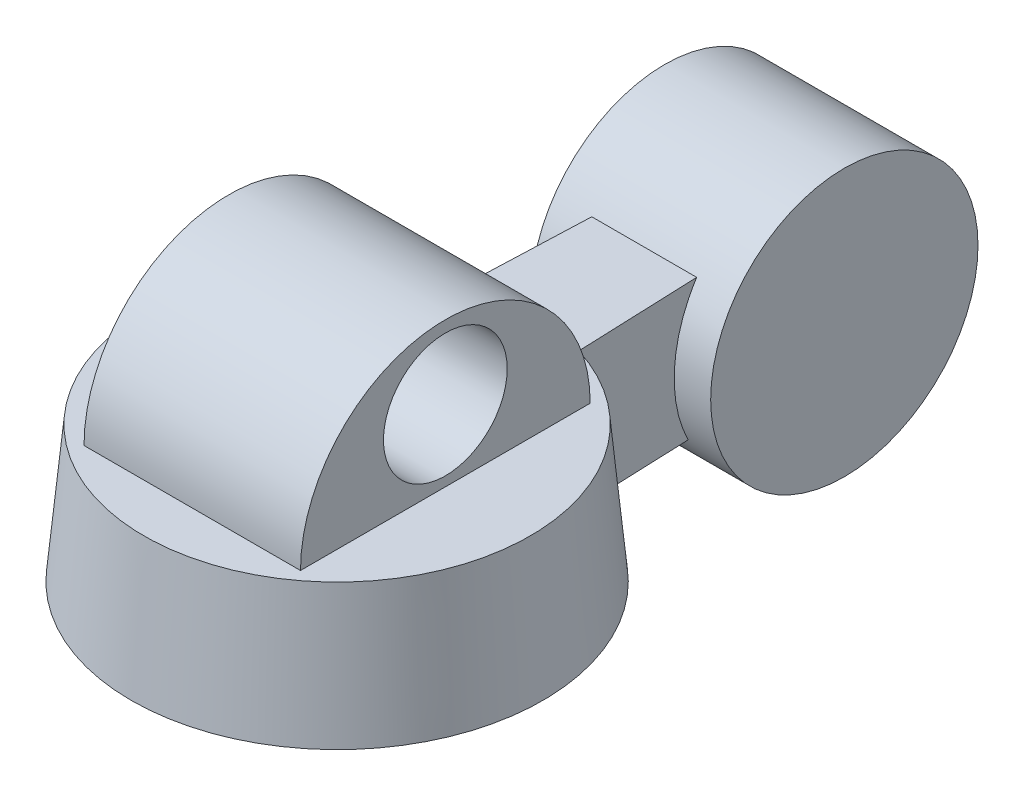
from build123d import *

# Parameters (mm, degrees)
BOSS_EXTRUDE1_DEPTH      = 24.380571
BOSS_EXTRUDE1_DEPTH_BACK = 24.380571
SKETCH2_R                = 13.935202
BOSS_EXTRUDE2_DEPTH      = 30.655768
BOSS_EXTRUDE3_DEPTH      = 20.236561
BOSS_EXTRUDE3_DEPTH_BACK = 20.236561
SKETCH5_R                = 30.106112


with BuildPart() as part:
    # Sketch1 → Revolve1 (revolve)
    with BuildSketch(Plane.XY):
        Polygon((-40.3145498, 0), (-46.3804, 0), (-43.5102, 30.655768), (0, 30.655768), (0, 11.70178), (-40.3145498, 11.70178), align=None)
    revolve(axis=Axis((0, 0, 0), (0, -1, 0)))

    # Sketch2 → Boss-Extrude1 (add, two sides: drawn at the far end of the back side and taken through both)
    with BuildSketch(Plane(origin=(0, 0, 0), x_dir=(0, 0, -1), z_dir=(1, 0, 0)).offset(-BOSS_EXTRUDE1_DEPTH_BACK)):
        with BuildLine():
            Line((0, 30.655768), (-32.625284, 30.655768))
            ThreePointArc((-32.625284, 30.655768), (0, 63.281052), (32.625284, 30.655768))
            Line((32.625284, 30.655768), (0, 30.655768))
        make_face()
        with Locations((0, 46.734476)):
            Circle(SKETCH2_R, mode=Mode.SUBTRACT)
    extrude(amount=BOSS_EXTRUDE1_DEPTH + BOSS_EXTRUDE1_DEPTH_BACK)

    # Sketch4 → Boss-Extrude2 (add)
    with BuildSketch(Plane(origin=(0, 0, 0), x_dir=(1, 0, 0), z_dir=(0, 1, 0))):
        Polygon((12.72794, 45.609256), (10.780776, 95.954596), (-10.780776, 95.954596), (-12.72794, 45.609256), (-12.927645356, 40.445728926), (12.927645356, 40.445728926), align=None)
    extrude(amount=BOSS_EXTRUDE2_DEPTH)

    # Sketch5 → Boss-Extrude3 (add, two sides: drawn at the far end of the back side and taken through both)
    with BuildSketch(Plane(origin=(0, 0, 0), x_dir=(0, 0, -1), z_dir=(1, 0, 0)).offset(-BOSS_EXTRUDE3_DEPTH_BACK)):
        with Locations((94.013528, 13.638022)):
            Circle(SKETCH5_R)
    extrude(amount=BOSS_EXTRUDE3_DEPTH + BOSS_EXTRUDE3_DEPTH_BACK)


solid = part.part
